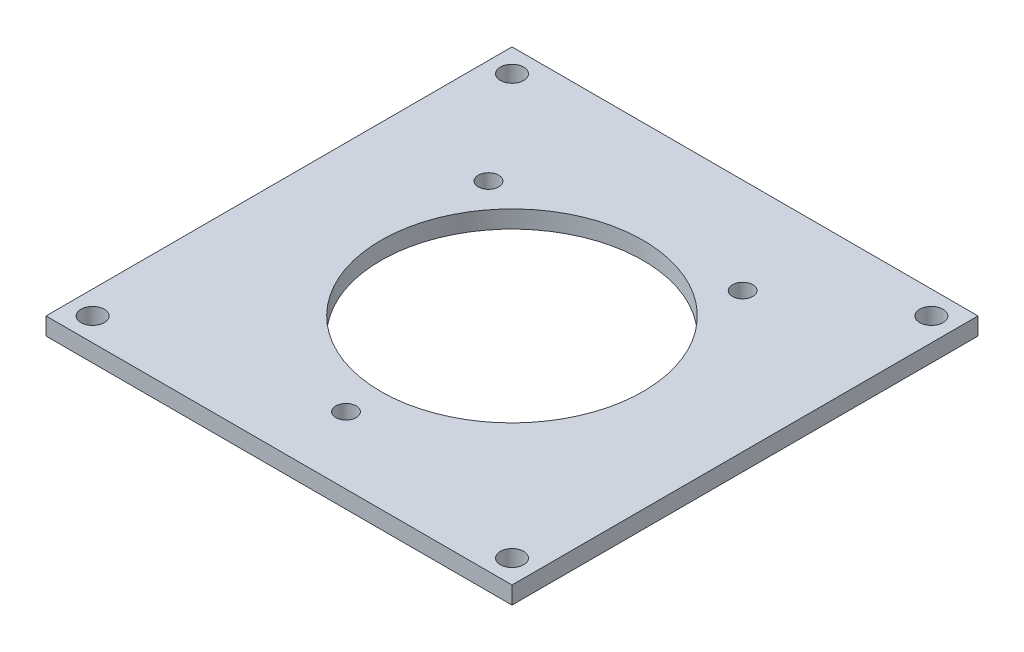
from build123d import *

# Parameters (mm, degrees)
ESQUISSE1_W      = 80
ESQUISSE1_H      = 80
ESQUISSE1_R      = 2
ESQUISSE1_R_2    = 1.75
ESQUISSE1_R_3    = 22.5
EXTRUSION1_DEPTH = 3


with BuildPart() as part:
    # Esquisse1 → Extrusion1 (new body)
    with BuildSketch(Plane(origin=(0, 0, 0), x_dir=(1, 0, 0), z_dir=(0, 1, 0))):
        Rectangle(ESQUISSE1_W, ESQUISSE1_H)
        with Locations(Location((-36, 36, 0), (0, 0, 270))):
            Circle(ESQUISSE1_R, mode=Mode.SUBTRACT)
        with Locations(Location((-22.07133422, 18.030701754, 0), (0, 0, 270))):
            Circle(ESQUISSE1_R_2, mode=Mode.SUBTRACT)
        with Locations(Location((0, -28.5, 0), (0, 0, 270))):
            Circle(ESQUISSE1_R_2, mode=Mode.SUBTRACT)
        with Locations(Location((16.028756412, 23.565418899, 0), (0, 0, 270))):
            Circle(ESQUISSE1_R_2, mode=Mode.SUBTRACT)
        with Locations(Location((36, 36, 0), (0, 0, 90))):
            Circle(ESQUISSE1_R, mode=Mode.SUBTRACT)
        with Locations(Location((-36, -36, 0), (0, 0, 90))):
            Circle(ESQUISSE1_R, mode=Mode.SUBTRACT)
        with Locations(Location((36, -36, 0), (0, 0, 270))):
            Circle(ESQUISSE1_R, mode=Mode.SUBTRACT)
        with Locations(Location((0, 0, 0), (0, 0, 270))):
            Circle(ESQUISSE1_R_3, mode=Mode.SUBTRACT)
    extrude(amount=EXTRUSION1_DEPTH)


solid = part.part
